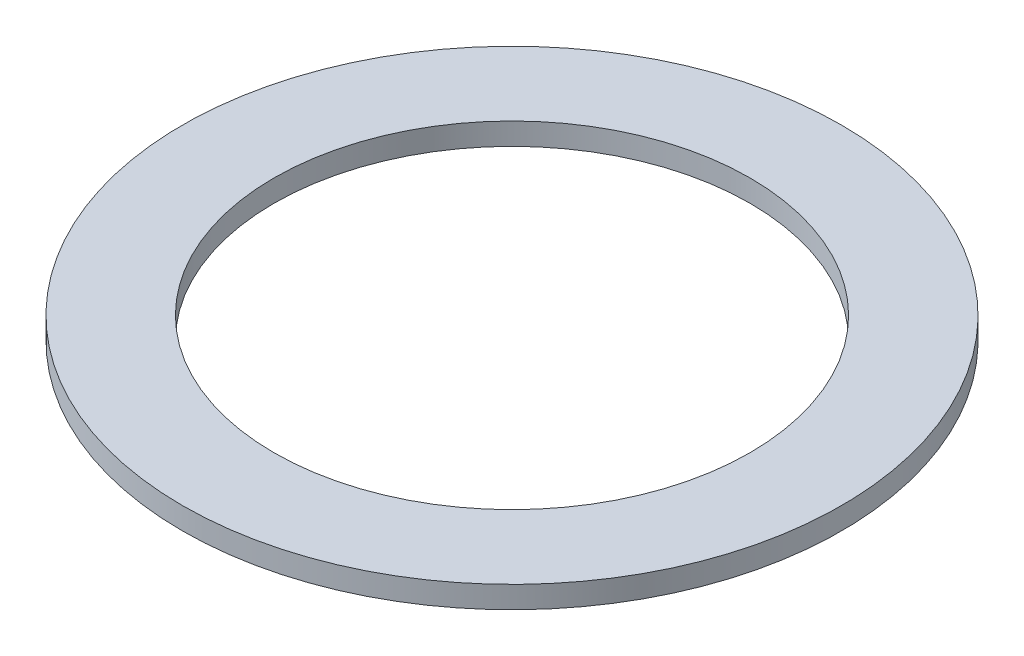
from build123d import *

# Parameters (mm, degrees)
SKETCH1_R           = 45
SKETCH1_R_2         = 32.5
BOSS_EXTRUDE1_DEPTH = 3


with BuildPart() as part:
    # Sketch1 → Boss-Extrude1 (new body)
    with BuildSketch(Plane(origin=(0, 0, 0), x_dir=(1, 0, 0), z_dir=(0, 1, 0))):
        with Locations(Location((0, 0, 0), (0, 0, 270))):
            Circle(SKETCH1_R)
        with Locations(Location((0, 0, 0), (0, 0, 270))):
            Circle(SKETCH1_R_2, mode=Mode.SUBTRACT)
    extrude(amount=BOSS_EXTRUDE1_DEPTH)


solid = part.part
